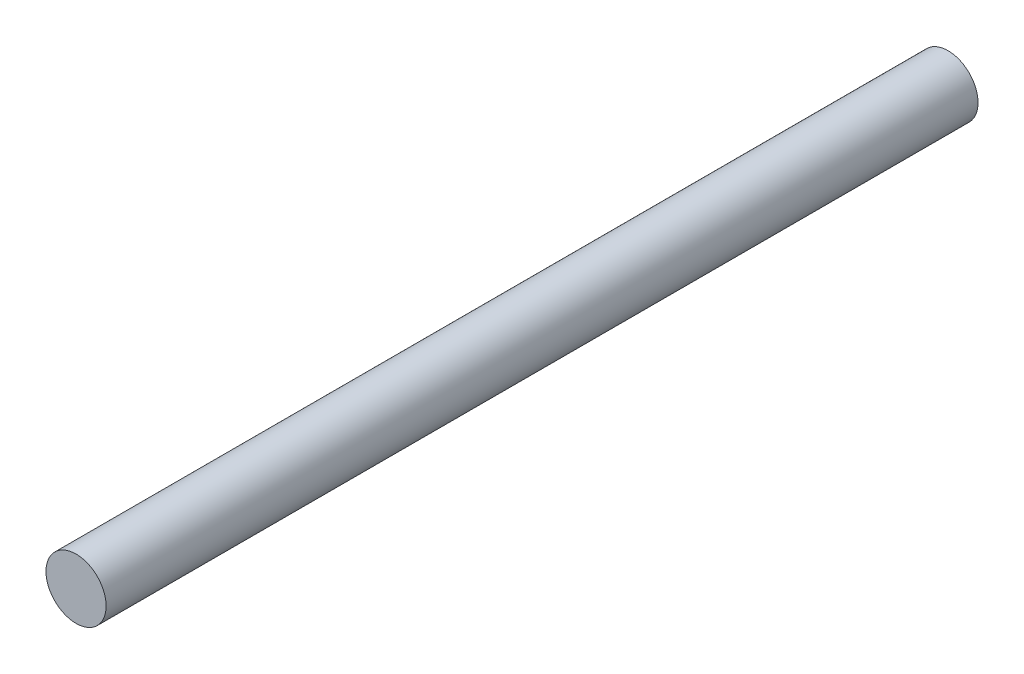
from build123d import *

# Parameters (mm, degrees)
IZIM1_R                     = 2
Y_KSEKLIK_EKSTR_ZYON1_DEPTH = 58
IZIM3_R                     = 1.75
KES_EKSTR_ZYON1_DEPTH       = 3


with BuildPart() as part:
    # Çizim1 → Yükseklik-Ekstrüzyon1 (new body)
    with BuildSketch(Plane.XY):
        with Locations(Location((0, 0, 0), (0, 0, 180))):
            Circle(IZIM1_R)
    extrude(amount=Y_KSEKLIK_EKSTR_ZYON1_DEPTH)

    # Çizim3 → Kes-Ekstrüzyon1 (cut)
    with BuildSketch(Plane(origin=(0, 0, 0), x_dir=(-1, 0, 0), z_dir=(0, 0, -1))):
        Circle(IZIM3_R)
    extrude(amount=-KES_EKSTR_ZYON1_DEPTH, mode=Mode.SUBTRACT)


solid = part.part
